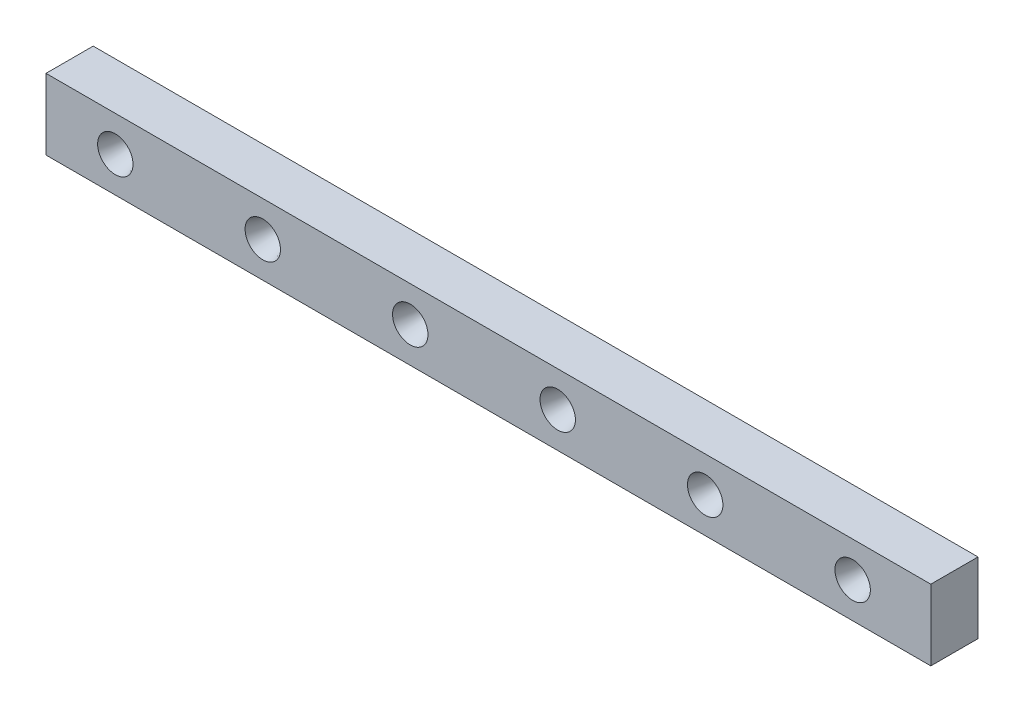
from build123d import *

# Parameters (mm, degrees)
SKETCH1_W           = 8
SKETCH1_H           = 12
BOSS_EXTRUDE1_DEPTH = 150
LPATTERN1_COUNT     = 6
LPATTERN1_PITCH     = 25


with BuildPart() as part:
    # Sketch1 → Boss-Extrude1 (new body)
    with BuildSketch(Plane(origin=(0, 0, 0), x_dir=(0, 0, -1), z_dir=(1, 0, 0))):
        Rectangle(SKETCH1_W, SKETCH1_H)
    extrude(amount=BOSS_EXTRUDE1_DEPTH)

    # Sketch4 → Cut-Revolve1 (revolve, cut)
    with BuildSketch(Plane.ZY.offset(-11.75), mode=Mode.PRIVATE) as cut_revolve1_sk:
        Polygon((4, 0), (-4, 0), (-4, -1.75), (0, -1.75), (4, -3), align=None)
    cut_revolve1 = revolve(cut_revolve1_sk.sketch.rotate(Axis((11.75, 0, 4), (0, 0, -1)), 270), axis=Axis((11.75, 0, 4), (0, 0, -1)), mode=Mode.SUBTRACT)

    # LPattern1: Cut-Revolve1 ×6
    with Locations(*[(i * LPATTERN1_PITCH, 0, 0) for i in range(1, LPATTERN1_COUNT)]):
        add(cut_revolve1, mode=Mode.SUBTRACT)


solid = part.part
